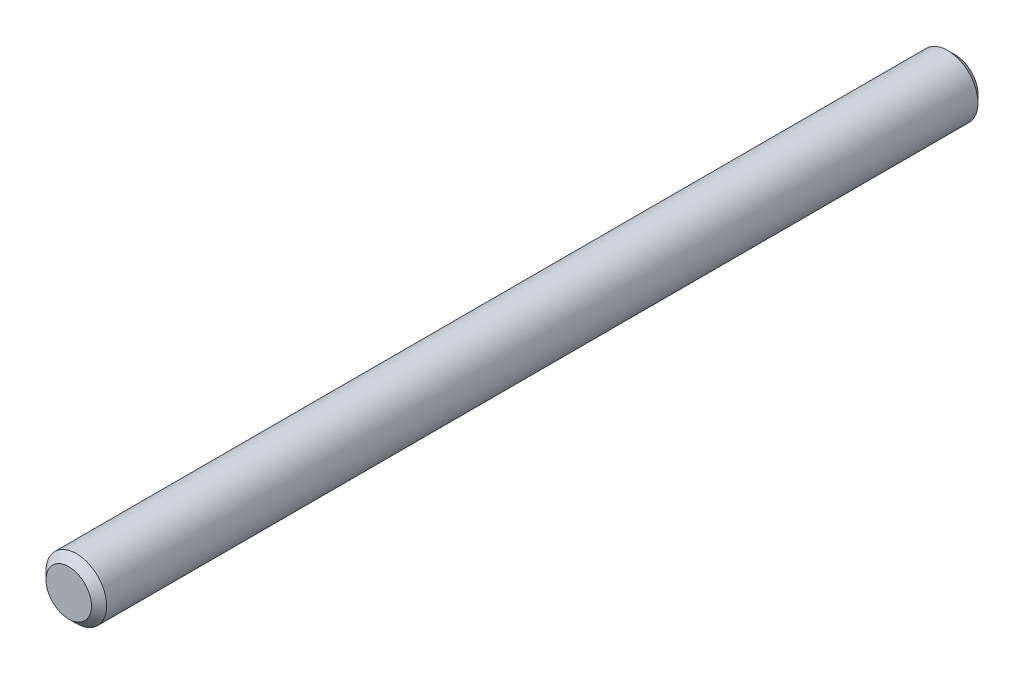
from build123d import *

# Parameters (mm, degrees)
SKETCH1_R           = 0.4
BOSS_EXTRUDE1_DEPTH = 11.7
CHAMFER1_SIZE       = 0.1


with BuildPart() as part:
    # Sketch1 → Boss-Extrude1 (new body)
    with BuildSketch(Plane.XY):
        Circle(SKETCH1_R)
    extrude(amount=BOSS_EXTRUDE1_DEPTH)

    # Chamfer1
    chamfer1_edges = [part.edges().sort_by_distance(p)[0] for p in [
        (-0.4, 0, 0),
        (-0.4, 0, 11.7),
    ]]
    chamfer(chamfer1_edges, length=CHAMFER1_SIZE)


solid = part.part
